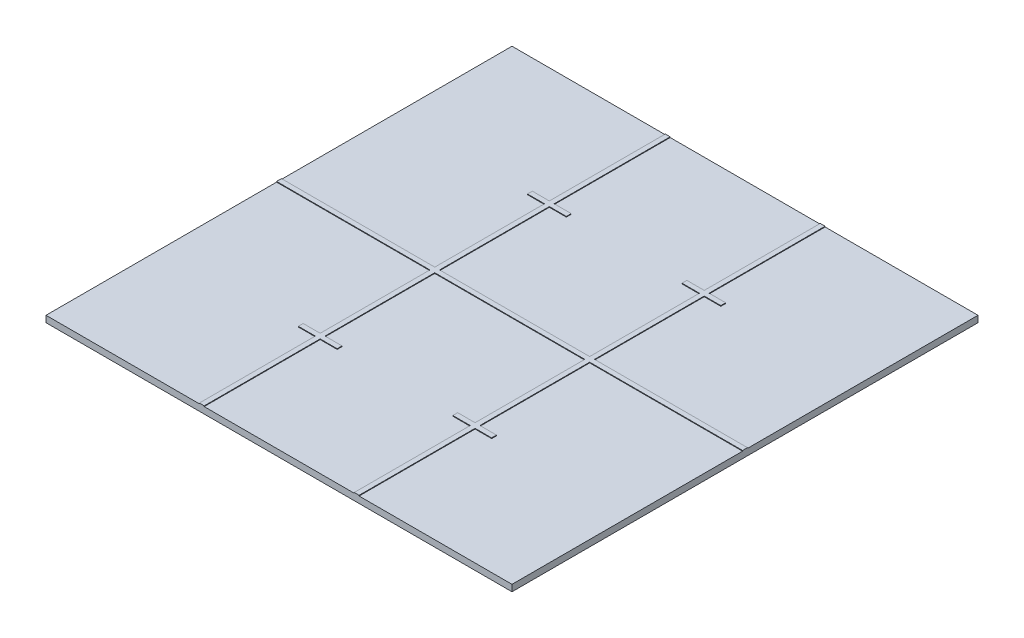
from build123d import *

# Parameters (mm, degrees)
SKETCH1_W           = 1828.8
SKETCH1_H           = 1828.8
BOSS_EXTRUDE1_DEPTH = 25.4
BOSS_EXTRUDE2_DEPTH = 2.54


with BuildPart() as part:
    # Sketch1 → Boss-Extrude1 (new body)
    with BuildSketch(Plane(origin=(0, 0, 0), x_dir=(1, 0, 0), z_dir=(0, 1, 0))):
        with Locations((850.696210424, 904.080811624)):
            Rectangle(SKETCH1_W, SKETCH1_H)
    extrude(amount=BOSS_EXTRUDE1_DEPTH)

    # Sketch2 → Boss-Extrude2 (add)
    with BuildSketch(Plane(origin=(0, 25.4, 0), x_dir=(1, 0, 0), z_dir=(0, 1, 0))):
        Polygon((1765.096210424, 913.605811624), (1765.096210424, 894.555811624), (1165.021210424, 894.555811624), (1165.021210424, 463.924675702), (1230.050709734, 463.924675702), (1230.050709734, 444.874675702), (1165.021210424, 444.874675702), (1165.021210424, -10.319188376), (1145.971210424, -10.319188376), (1145.971210424, 444.874675702), (1077.650709734, 444.874675702), (1077.650709734, 463.924675702), (1145.971210424, 463.924675702), (1145.971210424, 894.555811624), (557.066711115, 894.555811624), (557.066711115, 463.924675702), (623.741711115, 463.924675702), (623.741711115, 444.874675702), (557.066711115, 444.874675702), (557.066711115, -10.319188376), (538.016711115, -10.319188376), (538.016711115, 444.874675702), (471.341711115, 444.874675702), (471.341711115, 463.924675702), (538.016711115, 463.924675702), (538.016711115, 894.555811624), (-63.703789576, 894.555811624), (-63.703789576, 913.605811624), (538.016711115, 913.605811624), (538.016711115, 1344.236947546), (471.341711115, 1344.236947546), (471.341711115, 1363.286947546), (538.016711115, 1363.286947546), (538.016711115, 1818.480811624), (557.066711115, 1818.480811624), (557.066711115, 1363.286947546), (623.741711115, 1363.286947546), (623.741711115, 1344.236947546), (557.066711115, 1344.236947546), (557.066711115, 913.605811624), (1145.971210424, 913.605811624), (1145.971210424, 1344.236947546), (1077.650709734, 1344.236947546), (1077.650709734, 1363.286947546), (1145.971210424, 1363.286947546), (1145.971210424, 1818.480811624), (1155.496210424, 1818.480811624), (1165.021210424, 1818.480811624), (1165.021210424, 1363.286947546), (1230.050709734, 1363.286947546), (1230.050709734, 1344.236947546), (1165.021210424, 1344.236947546), (1165.021210424, 913.605811624), align=None)
    extrude(amount=BOSS_EXTRUDE2_DEPTH)


solid = part.part
